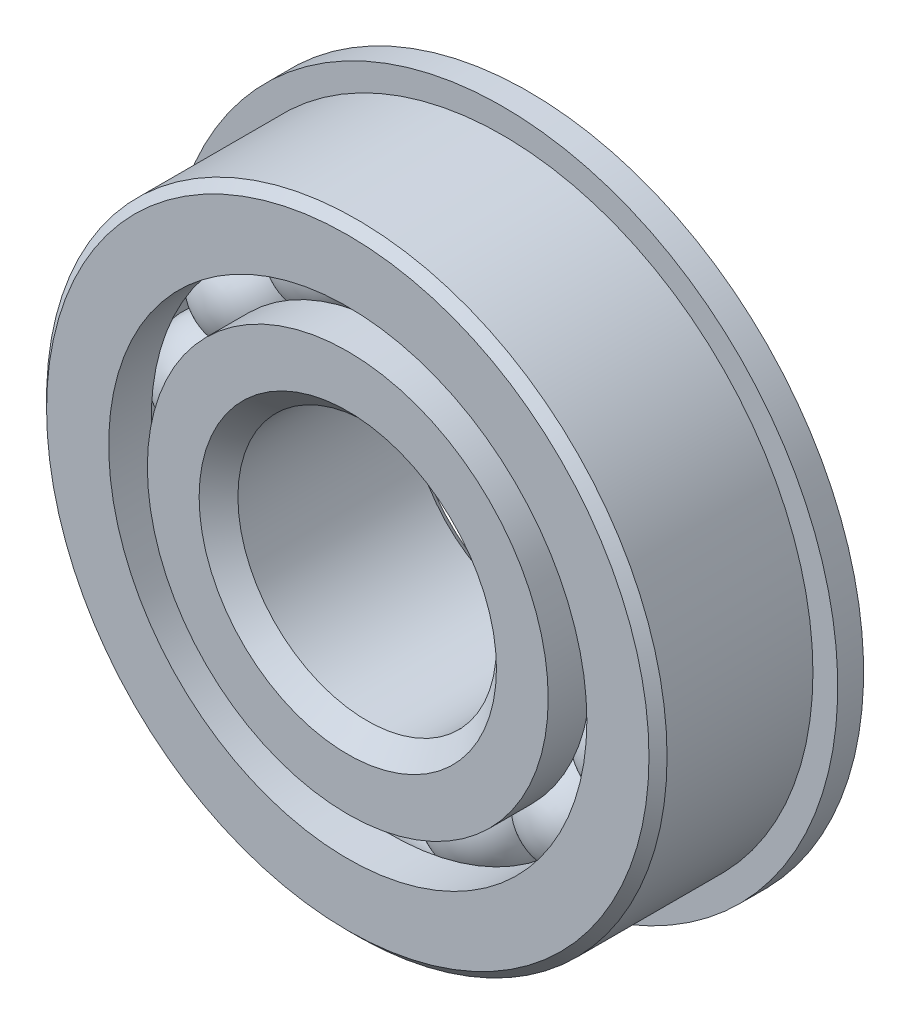
from build123d import *

# Parameters (mm, degrees)
CIRPATTERN1_COUNT = 13
SKETCH5_W         = 1.5875
SKETCH5_H         = 3.986209011


with BuildPart() as part:
    # Sketch1 → Revolve1 (revolve)
    with BuildSketch(Plane(origin=(0, 0, 0), x_dir=(0, 0, -1), z_dir=(1, 0, 0))):
        with BuildLine():
            Line((4.99491, 19.05), (-4.99491, 19.05))
            Line((-4.99491, 19.05), (-5.5499, 18.49501))
            Line((-5.5499, 18.49501), (-5.5499, 14.680571978))
            Line((-5.5499, 14.680571978), (-2.944839315, 14.680571978))
            ThreePointArc((-2.944839315, 14.680571978), (0, 16.66875), (2.944839315, 14.680571978))
            Line((2.944839315, 14.680571978), (5.5499, 14.680571978))
            Line((5.5499, 14.680571978), (5.5499, 18.49501))
            Line((5.5499, 18.49501), (4.99491, 19.05))
        make_face()
    revolve(axis=Axis((0, 0, 5.5499), (0, 0, -1)))

    # Sketch5 → Revolve5 (revolve)
    with BuildSketch(Plane(origin=(0, 0, 0), x_dir=(0, 0, -1), z_dir=(1, 0, 0))):
        with Locations((4.75615, 18.580895495)):
            Rectangle(SKETCH5_W, SKETCH5_H)
    revolve(axis=Axis((0, 0, -6.753225), (0, 0, 1)))


with BuildPart() as body_2:
    # Sketch2 → Revolve2 (revolve)
    with BuildSketch(Plane(origin=(0, 0, 0), x_dir=(0, 0, -1), z_dir=(1, 0, 0))):
        with BuildLine():
            Line((-5.5499, 12.306928022), (-2.944839315, 12.306928022))
            ThreePointArc((-2.944839315, 12.306928022), (-1.776578906, 10.862325977), (0, 10.31875))
            Line((0, 10.31875), (0, 9.128125))
            Line((0, 9.128125), (-3.960498489, 9.128125))
            Line((-3.960498489, 9.128125), (-5.5499, 10.717526511))
            Line((-5.5499, 10.717526511), (-5.5499, 12.306928022))
        make_face()
    revolve(axis=Axis((0, 0, 5.5499), (0, 0, -1)))

    # Sketch3 → Revolve3 (revolve)
    with BuildSketch(Plane(origin=(0, 0, 0), x_dir=(0, 0, -1), z_dir=(1, 0, 0))):
        with BuildLine():
            Line((-5.5499, 10.717526511), (-3.960498489, 9.128125))
            Line((-3.960498489, 9.128125), (0, 9.128125))
            Line((0, 9.128125), (0, 10.31875))
            ThreePointArc((0, 10.31875), (1.776578906, 10.862325977), (2.944839315, 12.306928022))
            Line((2.944839315, 12.306928022), (6.753225, 12.306928022))
            Line((6.753225, 12.306928022), (6.753225, 8.49249))
            Line((6.753225, 8.49249), (6.198235, 7.9375))
            Line((6.198235, 7.9375), (-4.359275, 7.9375))
            Line((-4.359275, 7.9375), (-5.5499, 9.128125))
            Line((-5.5499, 9.128125), (-5.5499, 10.717526511))
        make_face()
    revolve(axis=Axis((0, 0, 5.5499), (0, 0, -1)))


with BuildPart() as body_3:
    # Sketch4 → Revolve4 (revolve)
    with BuildSketch(Plane(origin=(0, 0, 0), x_dir=(0, 0, -1), z_dir=(1, 0, 0))):
        with BuildLine():
            Line((-3.175, 13.49375), (3.175, 13.49375))
            ThreePointArc((3.175, 13.49375), (0, 16.66875), (-3.175, 13.49375))
        make_face()
    revolve(axis=Axis((0, 13.49375, 3.175), (0, 0, -1)))


with BuildPart() as cirpattern1_1:
    # CirPattern1: pattern copy
    add(body_3.part.rotate(Axis((0, 0, -5.5499), (0, 0, 1)), 1 * 360 / CIRPATTERN1_COUNT))


with BuildPart() as cirpattern1_2:
    # CirPattern1: pattern copy
    add(body_3.part.rotate(Axis((0, 0, -5.5499), (0, 0, 1)), 2 * 360 / CIRPATTERN1_COUNT))


with BuildPart() as cirpattern1_3:
    # CirPattern1: pattern copy
    add(body_3.part.rotate(Axis((0, 0, -5.5499), (0, 0, 1)), 3 * 360 / CIRPATTERN1_COUNT))


with BuildPart() as cirpattern1_4:
    # CirPattern1: pattern copy
    add(body_3.part.rotate(Axis((0, 0, -5.5499), (0, 0, 1)), 4 * 360 / CIRPATTERN1_COUNT))


with BuildPart() as cirpattern1_5:
    # CirPattern1: pattern copy
    add(body_3.part.rotate(Axis((0, 0, -5.5499), (0, 0, 1)), 5 * 360 / CIRPATTERN1_COUNT))


with BuildPart() as cirpattern1_6:
    # CirPattern1: pattern copy
    add(body_3.part.rotate(Axis((0, 0, -5.5499), (0, 0, 1)), 6 * 360 / CIRPATTERN1_COUNT))


with BuildPart() as cirpattern1_7:
    # CirPattern1: pattern copy
    add(body_3.part.rotate(Axis((0, 0, -5.5499), (0, 0, 1)), 7 * 360 / CIRPATTERN1_COUNT))


with BuildPart() as cirpattern1_8:
    # CirPattern1: pattern copy
    add(body_3.part.rotate(Axis((0, 0, -5.5499), (0, 0, 1)), 8 * 360 / CIRPATTERN1_COUNT))


with BuildPart() as cirpattern1_9:
    # CirPattern1: pattern copy
    add(body_3.part.rotate(Axis((0, 0, -5.5499), (0, 0, 1)), 9 * 360 / CIRPATTERN1_COUNT))


with BuildPart() as cirpattern1_10:
    # CirPattern1: pattern copy
    add(body_3.part.rotate(Axis((0, 0, -5.5499), (0, 0, 1)), 10 * 360 / CIRPATTERN1_COUNT))


with BuildPart() as cirpattern1_11:
    # CirPattern1: pattern copy
    add(body_3.part.rotate(Axis((0, 0, -5.5499), (0, 0, 1)), 11 * 360 / CIRPATTERN1_COUNT))


with BuildPart() as cirpattern1_12:
    # CirPattern1: pattern copy
    add(body_3.part.rotate(Axis((0, 0, -5.5499), (0, 0, 1)), 12 * 360 / CIRPATTERN1_COUNT))


solid = Compound([part.part, body_2.part, body_3.part, cirpattern1_1.part, cirpattern1_2.part, cirpattern1_3.part, cirpattern1_4.part, cirpattern1_5.part, cirpattern1_6.part, cirpattern1_7.part, cirpattern1_8.part, cirpattern1_9.part, cirpattern1_10.part, cirpattern1_11.part, cirpattern1_12.part])
